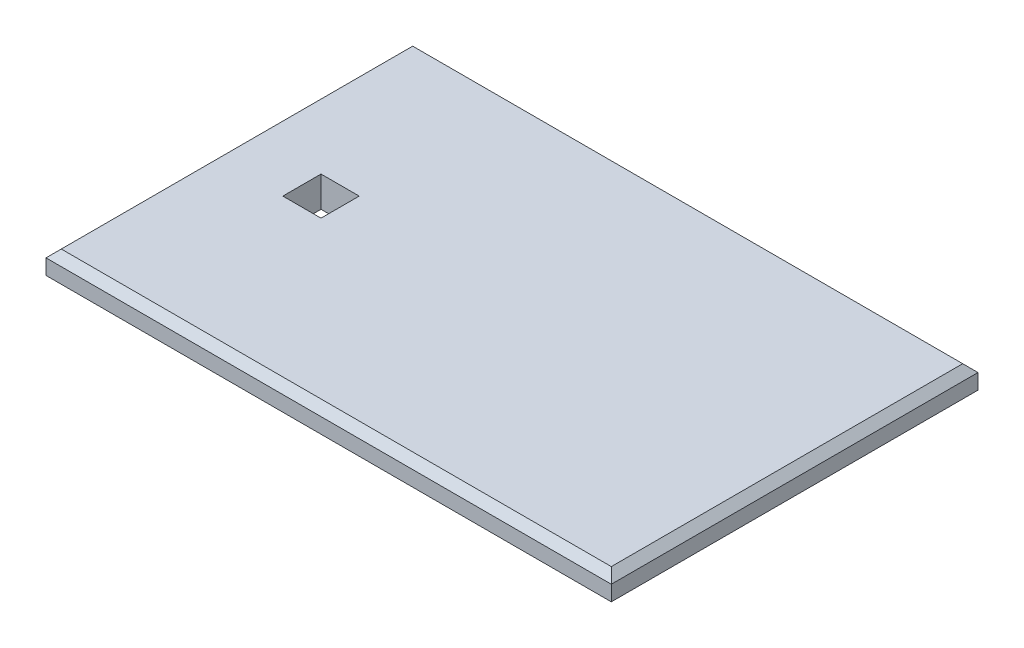
from build123d import *

# Parameters (mm, degrees)
SKETCH1_W           = 74
SKETCH1_H           = 48
SKETCH1_W_2         = 5
SKETCH1_H_2         = 5
BOSS_EXTRUDE1_DEPTH = 3
BOSS_EXTRUDE2_START = -1
SKETCH1_4_W         = 71.4
SKETCH1_4_H         = 45.4
SKETCH1_4_W_2       = 5
SKETCH1_4_H_2       = 5
BOSS_EXTRUDE2_DEPTH = 1
CHAMFER1_SIZE       = 1


with BuildPart() as part:
    # Sketch1 → Boss-Extrude1 (new body)
    with BuildSketch(Plane(origin=(0, 0, 0), x_dir=(1, 0, 0), z_dir=(0, 1, 0))):
        Rectangle(SKETCH1_W, SKETCH1_H)
        with Locations((-25, 0)):
            Rectangle(SKETCH1_W_2, SKETCH1_H_2, mode=Mode.SUBTRACT)
    extrude(amount=BOSS_EXTRUDE1_DEPTH)

    # Sketch1<4> → Boss-Extrude2 (add)
    with BuildSketch(Plane(origin=(0, 0, 0), x_dir=(1, 0, 0), z_dir=(0, 1, 0)).offset(BOSS_EXTRUDE2_START)):
        Rectangle(SKETCH1_4_W, SKETCH1_4_H)
        with Locations((-25, 0)):
            Rectangle(SKETCH1_4_W_2, SKETCH1_4_H_2, mode=Mode.SUBTRACT)
    extrude(amount=BOSS_EXTRUDE2_DEPTH)

    # Chamfer1
    chamfer1_edges = [part.edges().sort_by_distance(p)[0] for p in [
        (0, 3, 24),
        (37, 3, 0),
        (0, 3, -24),
        (-37, 3, 0),
    ]]
    chamfer(chamfer1_edges, length=CHAMFER1_SIZE)


solid = part.part
